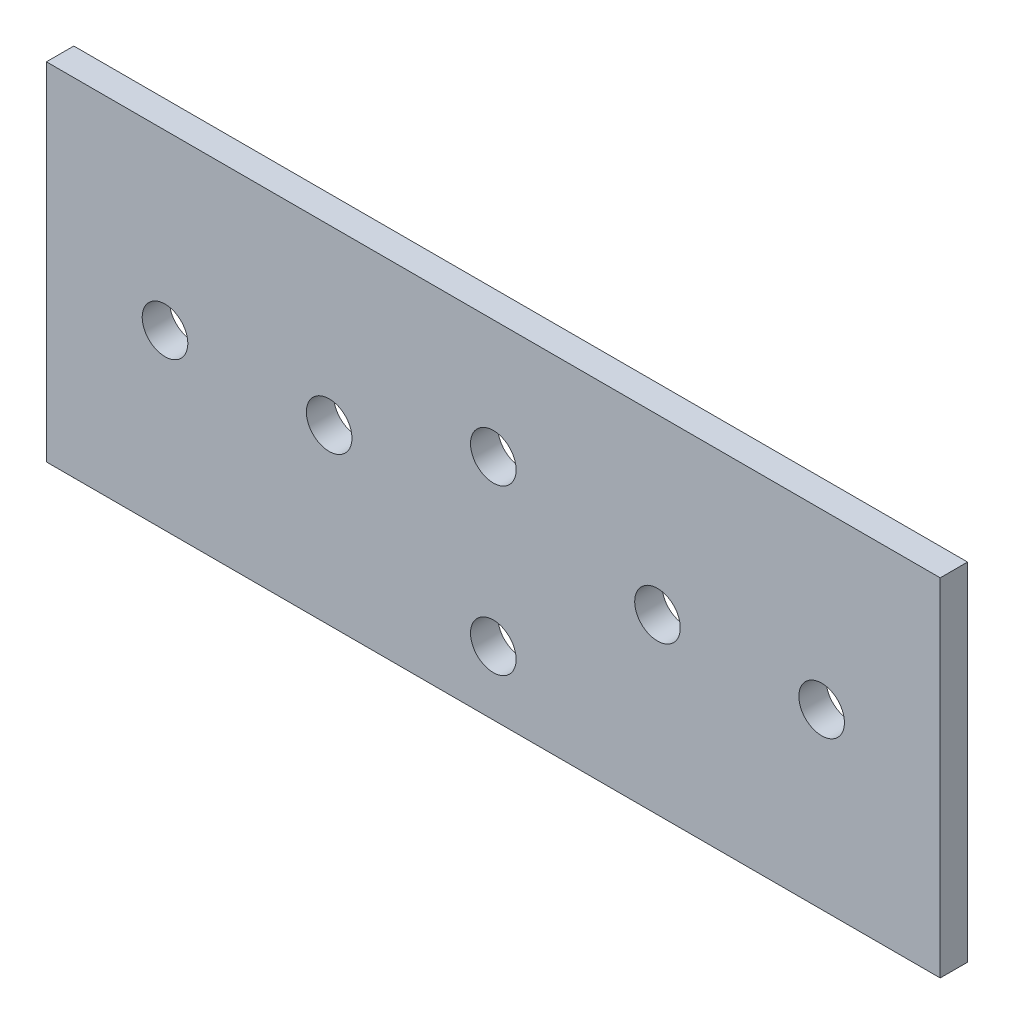
from build123d import *

# Parameters (mm, degrees)
SKETCH_1_W          = 98
SKETCH_1_H          = 38
EXTRUDE_1_DEPTH     = 3
CUT_EXTRUDE_1_REACH = 54.64
SKETCH_2_R          = 2.5
CUT_EXTRUDE_2_REACH = 54.64
SKETCH_3_R          = 2.5


with BuildPart() as part:
    # 草圖1 → 填料-伸長1 (new body)
    with BuildSketch(Plane.XY):
        Rectangle(SKETCH_1_W, SKETCH_1_H)
    extrude(amount=EXTRUDE_1_DEPTH)

    # 草圖2 → 除料-伸長1 (cut, up to next)
    with BuildSketch(Plane(origin=(0, 0, 0), x_dir=(-1, 0, 0), z_dir=(0, 0, -1)), mode=Mode.PRIVATE) as cut_extrude_1_sk1:
        with Locations((-36, 0)):
            Circle(SKETCH_2_R)
    cut_extrude_1_tool1 = extrude(cut_extrude_1_sk1.sketch, amount=-CUT_EXTRUDE_1_REACH, mode=Mode.PRIVATE) & part.part
    # 草圖2 → 除料-伸長1 (cut, up to next)
    with BuildSketch(Plane(origin=(0, 0, 0), x_dir=(-1, 0, 0), z_dir=(0, 0, -1)), mode=Mode.PRIVATE) as cut_extrude_1_sk2:
        with Locations((-18, 0)):
            Circle(SKETCH_2_R)
    cut_extrude_1_tool2 = extrude(cut_extrude_1_sk2.sketch, amount=-CUT_EXTRUDE_1_REACH, mode=Mode.PRIVATE) & part.part
    cut_extrude_1_1 = cut_extrude_1_tool1.solids().sort_by_distance((36, 0, 0))[0]
    add(cut_extrude_1_1, mode=Mode.SUBTRACT)
    cut_extrude_1_2 = cut_extrude_1_tool2.solids().sort_by_distance((18, 0, 0))[0]
    add(cut_extrude_1_2, mode=Mode.SUBTRACT)
    cut_extrude_1 = cut_extrude_1_1 + cut_extrude_1_2  # 除料-伸長1 as one shape, for the pattern or mirror that repeats it

    # 鏡射1: 除料-伸長1 across plane
    add(cut_extrude_1.mirror(Plane(origin=(0, 0, 0), x_dir=(0, 0, 1), z_dir=(1, 0, 0))), mode=Mode.SUBTRACT)

    # 草圖3 → 除料-伸長2 (cut, up to next)
    with BuildSketch(Plane(origin=(0, 0, 0), x_dir=(-1, 0, 0), z_dir=(0, 0, -1)), mode=Mode.PRIVATE) as cut_extrude_2_sk1:
        with Locations((0, -12)):
            Circle(SKETCH_3_R)
    cut_extrude_2_tool1 = extrude(cut_extrude_2_sk1.sketch, amount=-CUT_EXTRUDE_2_REACH, mode=Mode.PRIVATE) & part.part
    # 草圖3 → 除料-伸長2 (cut, up to next)
    with BuildSketch(Plane(origin=(0, 0, 0), x_dir=(-1, 0, 0), z_dir=(0, 0, -1)), mode=Mode.PRIVATE) as cut_extrude_2_sk2:
        with Locations((0, 6)):
            Circle(SKETCH_3_R)
    cut_extrude_2_tool2 = extrude(cut_extrude_2_sk2.sketch, amount=-CUT_EXTRUDE_2_REACH, mode=Mode.PRIVATE) & part.part
    add(cut_extrude_2_tool1.solids().sort_by_distance((0, -12, 0))[0], mode=Mode.SUBTRACT)
    add(cut_extrude_2_tool2.solids().sort_by_distance((0, 6, 0))[0], mode=Mode.SUBTRACT)


solid = part.part
